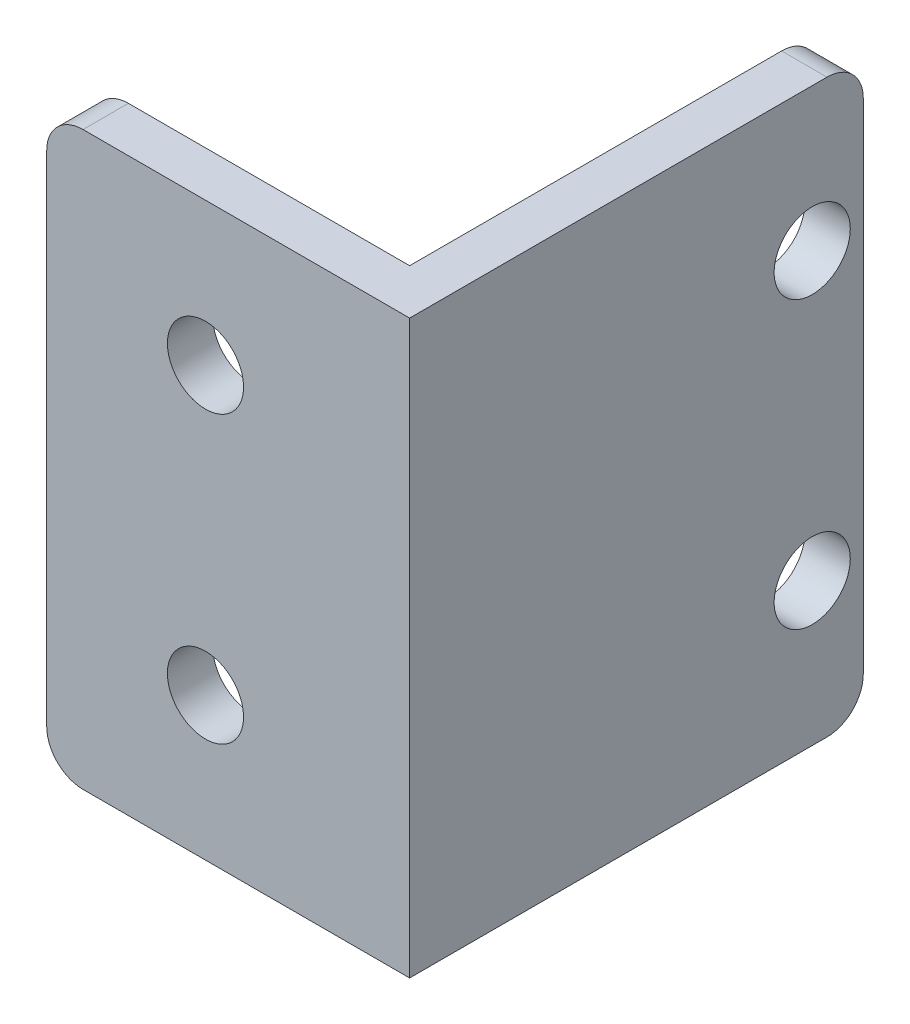
from build123d import *

# Parameters (mm, degrees)
BOSS_EXTRUDE1_DEPTH = 40
CUT_EXTRUDE1_REACH  = 57.333
SKETCH2_R           = 2.665
CUT_EXTRUDE2_REACH  = 59.037
SKETCH3_R           = 2.665
FILLET1_R           = 2.54


with BuildPart() as part:
    # Sketch1 → Boss-Extrude1 (new body)
    with BuildSketch(Plane(origin=(0, 0, 0), x_dir=(1, 0, 0), z_dir=(0, 1, 0))):
        Polygon((0, 0), (-25.4, 0), (-25.4, 3.175), (-3.175, 3.175), (-3.175, 31.75), (0, 31.75), align=None)
    extrude(amount=BOSS_EXTRUDE1_DEPTH)

    # Sketch2 → Cut-Extrude1 (cut, up to next)
    with BuildSketch(Plane(origin=(0, 0, -3.175), x_dir=(-1, 0, 0), z_dir=(0, 0, -1)), mode=Mode.PRIVATE) as cut_extrude1_sk1:
        with Locations((14.2875, 30)):
            Circle(SKETCH2_R)
    cut_extrude1_tool1 = extrude(cut_extrude1_sk1.sketch, amount=-CUT_EXTRUDE1_REACH, mode=Mode.PRIVATE) & part.part
    # Sketch2 → Cut-Extrude1 (cut, up to next)
    with BuildSketch(Plane(origin=(0, 0, -3.175), x_dir=(-1, 0, 0), z_dir=(0, 0, -1)), mode=Mode.PRIVATE) as cut_extrude1_sk2:
        with Locations((14.2875, 10)):
            Circle(SKETCH2_R)
    cut_extrude1_tool2 = extrude(cut_extrude1_sk2.sketch, amount=-CUT_EXTRUDE1_REACH, mode=Mode.PRIVATE) & part.part
    add(cut_extrude1_tool1.solids().sort_by_distance((-14.2875, 30, -3.175))[0], mode=Mode.SUBTRACT)
    add(cut_extrude1_tool2.solids().sort_by_distance((-14.2875, 10, -3.175))[0], mode=Mode.SUBTRACT)

    # Sketch3 → Cut-Extrude2 (cut, up to next)
    with BuildSketch(Plane(origin=(0, 0, 0), x_dir=(0, 0, -1), z_dir=(1, 0, 0)), mode=Mode.PRIVATE) as cut_extrude2_sk1:
        with Locations((28.17625, 10)):
            Circle(SKETCH3_R)
    cut_extrude2_tool1 = extrude(cut_extrude2_sk1.sketch, amount=-CUT_EXTRUDE2_REACH, mode=Mode.PRIVATE) & part.part
    # Sketch3 → Cut-Extrude2 (cut, up to next)
    with BuildSketch(Plane(origin=(0, 0, 0), x_dir=(0, 0, -1), z_dir=(1, 0, 0)), mode=Mode.PRIVATE) as cut_extrude2_sk2:
        with Locations((28.17625, 30)):
            Circle(SKETCH3_R)
    cut_extrude2_tool2 = extrude(cut_extrude2_sk2.sketch, amount=-CUT_EXTRUDE2_REACH, mode=Mode.PRIVATE) & part.part
    add(cut_extrude2_tool1.solids().sort_by_distance((0, 10, -28.17625))[0], mode=Mode.SUBTRACT)
    add(cut_extrude2_tool2.solids().sort_by_distance((0, 30, -28.17625))[0], mode=Mode.SUBTRACT)

    # Fillet1
    fillet1_edges = [part.edges().sort_by_distance(p)[0] for p in [
        (-25.4, 40, -1.5875),
        (-25.4, 0, -1.5875),
        (-1.5875, 40, -31.75),
        (-1.5875, 0, -31.75),
    ]]
    fillet(fillet1_edges, radius=FILLET1_R)


solid = part.part
